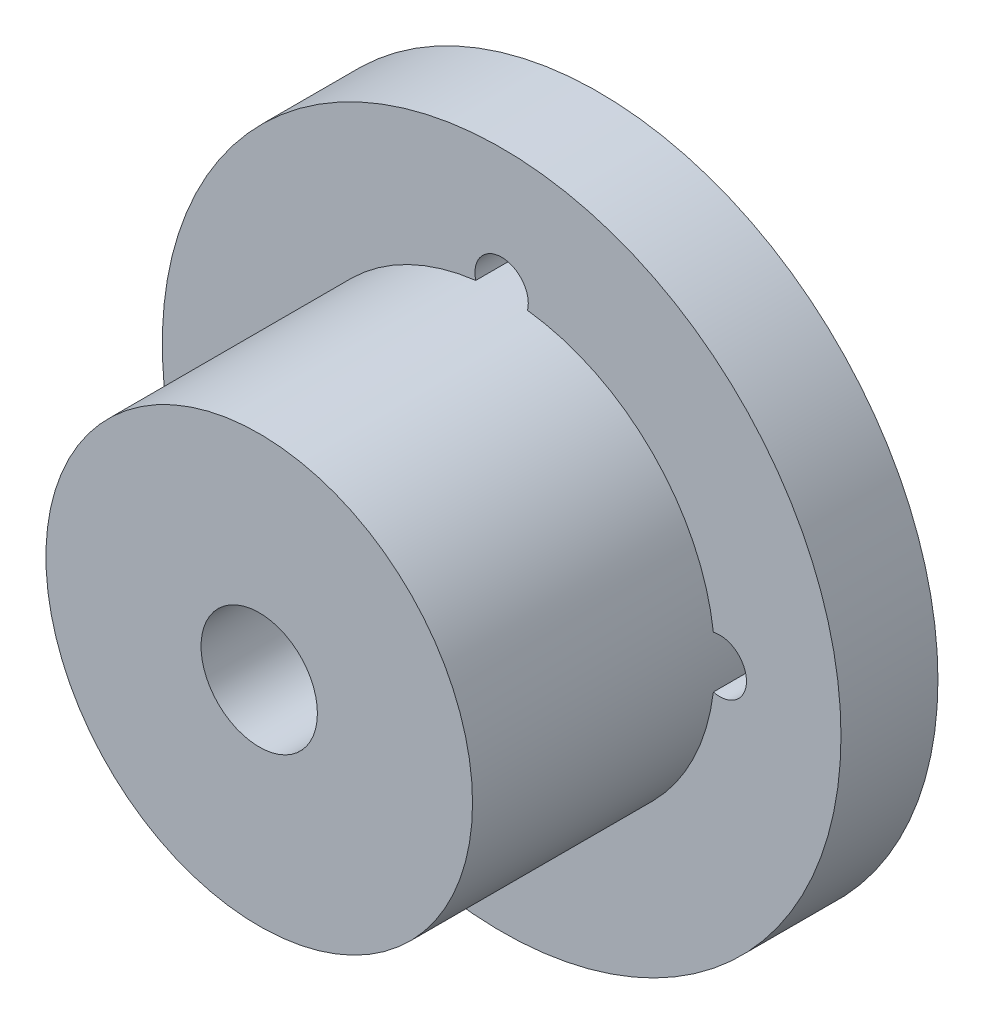
from build123d import *

# Parameters (mm, degrees)
SKETCH1_R           = 35
SKETCH1_R_2         = 6
SKETCH1_R_3         = 2.75
BOSS_EXTRUDE1_DEPTH = 10
SKETCH2_R           = 22
SKETCH2_R_2         = 6
BOSS_EXTRUDE2_DEPTH = 35
SKETCH3_R           = 12
SKETCH3_R_2         = 4
BOSS_EXTRUDE3_DEPTH = 20


with BuildPart() as part:
    # Sketch1 → Boss-Extrude1 (new body)
    with BuildSketch(Plane.XY):
        Circle(SKETCH1_R)
        Circle(SKETCH1_R_2, mode=Mode.SUBTRACT)
        with Locations((22.5, 0)):
            Circle(SKETCH1_R_3, mode=Mode.SUBTRACT)
        with Locations((0, 22.5)):
            Circle(SKETCH1_R_3, mode=Mode.SUBTRACT)
        with Locations((-22.5, 0)):
            Circle(SKETCH1_R_3, mode=Mode.SUBTRACT)
        with Locations((0, -22.5)):
            Circle(SKETCH1_R_3, mode=Mode.SUBTRACT)
    extrude(amount=BOSS_EXTRUDE1_DEPTH)

    # Sketch2 → Boss-Extrude2 (add)
    with BuildSketch(Plane.XY):
        Circle(SKETCH2_R)
        Circle(SKETCH2_R_2, mode=Mode.SUBTRACT)
    extrude(amount=BOSS_EXTRUDE2_DEPTH)

    # Sketch3 → Boss-Extrude3 (add)
    with BuildSketch(Plane.XY):
        Circle(SKETCH3_R)
        Circle(SKETCH3_R_2, mode=Mode.SUBTRACT)
    extrude(amount=BOSS_EXTRUDE3_DEPTH)


solid = part.part
